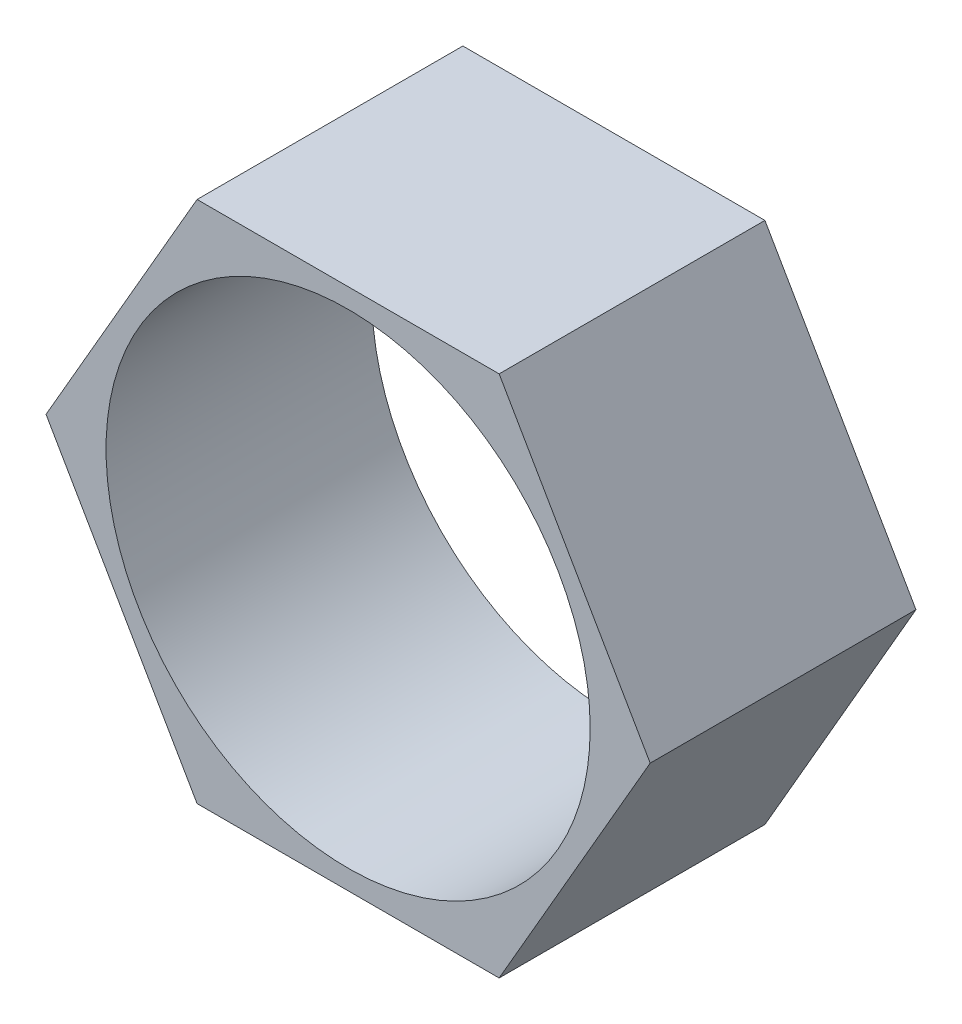
from build123d import *

# Parameters (mm, degrees)
BOSS_EXTRUDE1_DEPTH = 12.7
SKETCH2_R           = 11.5665
CUT_EXTRUDE1_DEPTH  = 12.7


with BuildPart() as part:
    # Sketch1 → Boss-Extrude1 (new body)
    with BuildSketch(Plane.XY):
        Polygon((-10.620198345, 11.583111088), (-17.83707671, -0.916888912), (-10.620198345, -13.416888912), (3.813558385, -13.416888912), (11.03043675, -0.916888912), (3.813558385, 11.583111088), align=None)
    extrude(amount=BOSS_EXTRUDE1_DEPTH)

    # Sketch2 → Cut-Extrude1 (cut)
    with BuildSketch(Plane.XY.offset(12.7)):
        with Locations((-3.40331998, -0.916888912)):
            Circle(SKETCH2_R)
    extrude(amount=-CUT_EXTRUDE1_DEPTH, mode=Mode.SUBTRACT)


solid = part.part
